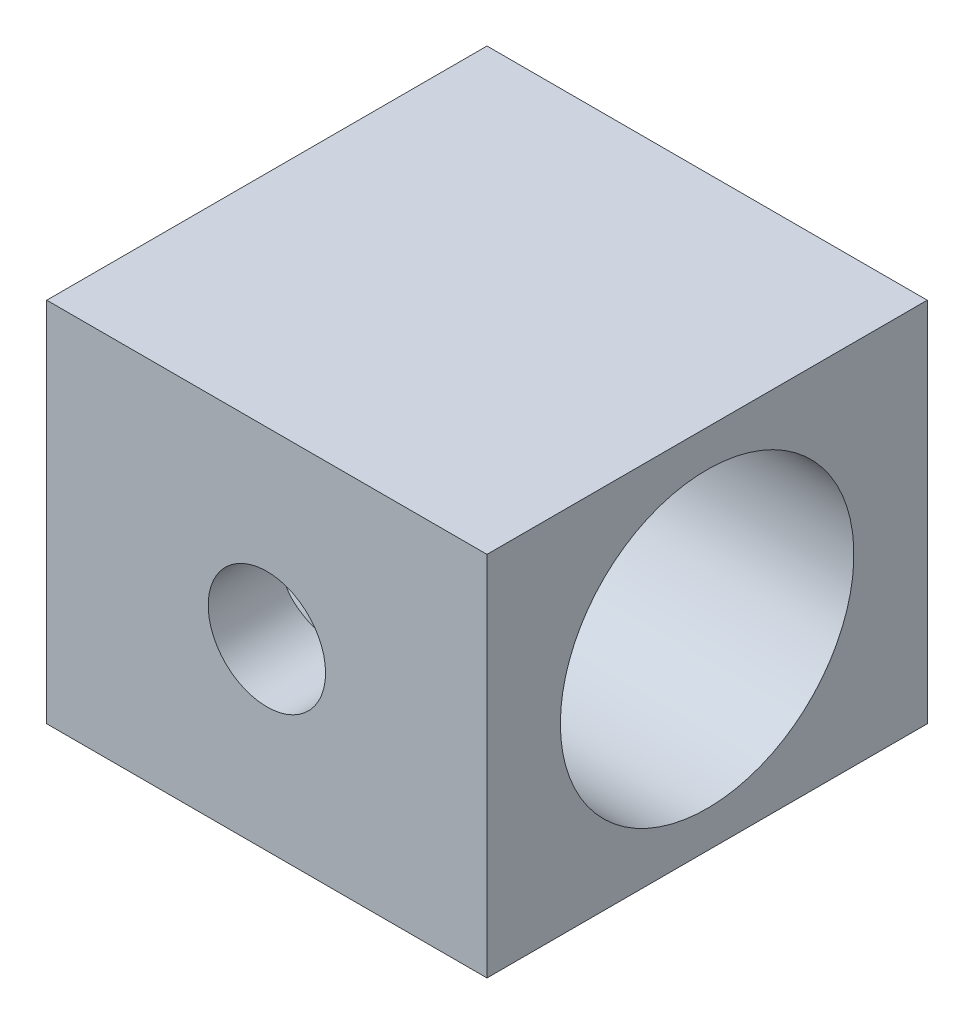
from build123d import *

# Parameters (mm, degrees)
SKETCH_1_W               = 30
SKETCH_1_H               = 25
EXTRUDE_1_DEPTH          = 15
SKETCH_3_R               = 10
CUT_EXTRUDE_1_DEPTH      = 36.794552658
CUT_EXTRUDE_2_REACH      = 37.795
CUT_EXTRUDE_2_END_RADIUS = 10
SKETCH_4_R               = 4


with BuildPart() as part:
    # 草图1 → 凸台-拉伸1 (new, symmetric)
    with BuildSketch(Plane.XY):
        Rectangle(SKETCH_1_W, SKETCH_1_H)
    extrude(amount=EXTRUDE_1_DEPTH, both=True)

    # 草图3 → 切除-拉伸1 (cut, through all)
    with BuildSketch(Plane.ZY.offset(15)):
        Circle(SKETCH_3_R)
    extrude(amount=-CUT_EXTRUDE_1_DEPTH, mode=Mode.SUBTRACT)

    # 切除-拉伸2: up to this cylinder (the profile starts outside it)
    cut_extrude_2_end = Plane(origin=(0, 0, 0), z_dir=(-1, 0, 0)) * Cylinder(CUT_EXTRUDE_2_END_RADIUS, 96.59, mode=Mode.PRIVATE)
    # 草图4 → 切除-拉伸2 (cut, up to the surface)
    with BuildSketch(Plane.XY.offset(15), mode=Mode.PRIVATE) as cut_extrude_2_sk1:
        Circle(SKETCH_4_R)
    cut_extrude_2_tool1 = extrude(cut_extrude_2_sk1.sketch, amount=-CUT_EXTRUDE_2_REACH, mode=Mode.PRIVATE) - cut_extrude_2_end
    add(cut_extrude_2_tool1.solids().sort_by_distance((0, 0, 15))[0], mode=Mode.SUBTRACT)


solid = part.part
